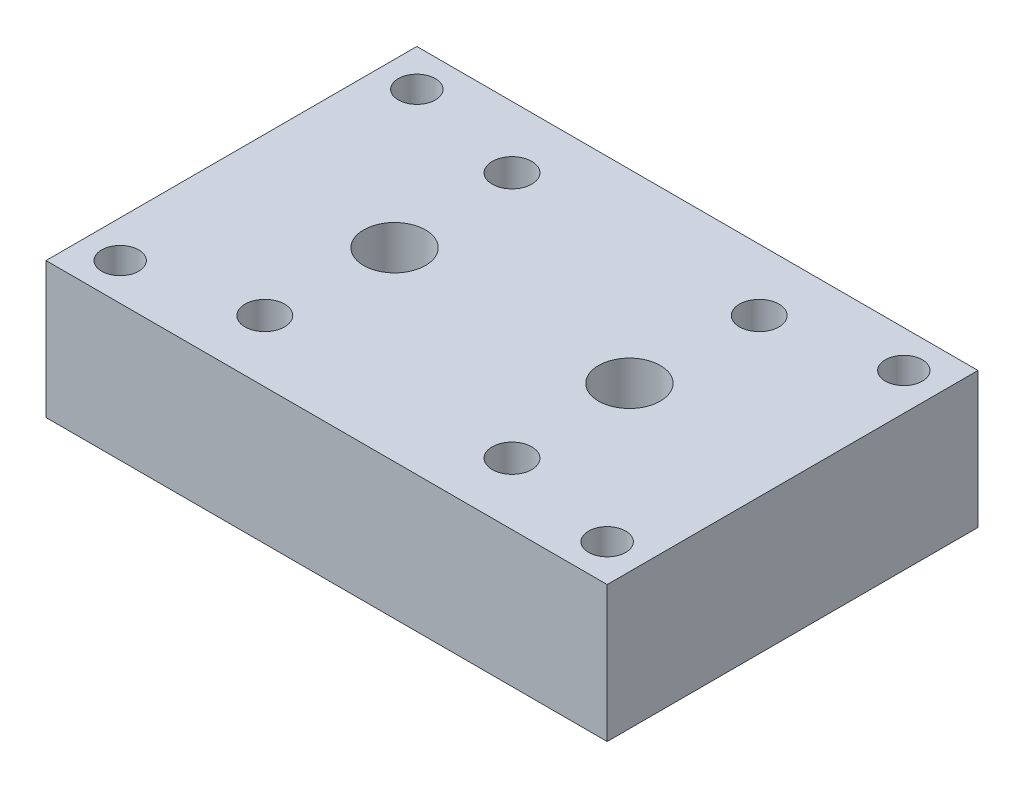
from build123d import *

# Parameters (mm, degrees)
SKETCH1_W             = 45.4
SKETCH1_H             = 30
BOSS_EXTRUDE1_DEPTH   = 11
SKETCH2_R             = 2.5
CUT_EXTRUDE1_DEPTH    = 30.347742673
F_3_0MM_DOWEL_HOLE1_D = 3.2
SKETCH5_R             = 3
BOSS_EXTRUDE2_DEPTH   = 4.5
SKETCH6_R             = 1.75
BOSS_EXTRUDE3_DEPTH   = 3
SKETCH7_R             = 1.5
CUT_EXTRUDE2_DEPTH    = 4


with BuildPart() as part:
    # Sketch1 → Boss-Extrude1 (new body)
    with BuildSketch(Plane(origin=(0, 0, 0), x_dir=(1, 0, 0), z_dir=(0, 1, 0))):
        Rectangle(SKETCH1_W, SKETCH1_H)
    extrude(amount=BOSS_EXTRUDE1_DEPTH)

    # Sketch2 → Cut-Extrude1 (cut, through all)
    with BuildSketch(Plane(origin=(0, 11, 0), x_dir=(1, 0, 0), z_dir=(0, 1, 0))):
        with Locations(Location((-9.5, 0, 0), (0, 0, 270))):
            Circle(SKETCH2_R)
        with Locations(Location((9.5, 0, 0), (0, 0, 270))):
            Circle(SKETCH2_R)
    extrude(amount=-CUT_EXTRUDE1_DEPTH, mode=Mode.SUBTRACT)

    # Ø3.0mm Dowel Hole1 (through all)
    with Locations(Plane(origin=(0, 11, 0), x_dir=(1, 0, 0), z_dir=(0, 1, 0))):
        with Locations((-10, 10), (10, 10), (10, -10), (-10, -10)):
            Hole(F_3_0MM_DOWEL_HOLE1_D / 2)

    # Sketch5 → Boss-Extrude2 (add)
    with BuildSketch(Plane.XZ):
        with Locations(Location((0, -5, 0), (0, 0, 270))):
            Circle(SKETCH5_R)
    extrude(amount=BOSS_EXTRUDE2_DEPTH)

    # Sketch6 → Boss-Extrude3 (add)
    with BuildSketch(Plane.XZ.offset(4.5)):
        with Locations(Location((0, -5, 0), (0, 0, 270))):
            Circle(SKETCH6_R)
    extrude(amount=BOSS_EXTRUDE3_DEPTH)

    # Sketch7 → Cut-Extrude2 (cut)
    with BuildSketch(Plane(origin=(0, 11, 0), x_dir=(1, 0, 0), z_dir=(0, 1, 0))):
        with Locations(Location((-19.7, 12, 0), (0, 0, 270))):
            Circle(SKETCH7_R)
        with Locations(Location((19.7, 12, 0), (0, 0, 270))):
            Circle(SKETCH7_R)
        with Locations(Location((19.7, -12, 0), (0, 0, 270))):
            Circle(SKETCH7_R)
        with Locations(Location((-19.7, -12, 0), (0, 0, 270))):
            Circle(SKETCH7_R)
    extrude(amount=-CUT_EXTRUDE2_DEPTH, mode=Mode.SUBTRACT)


solid = part.part
